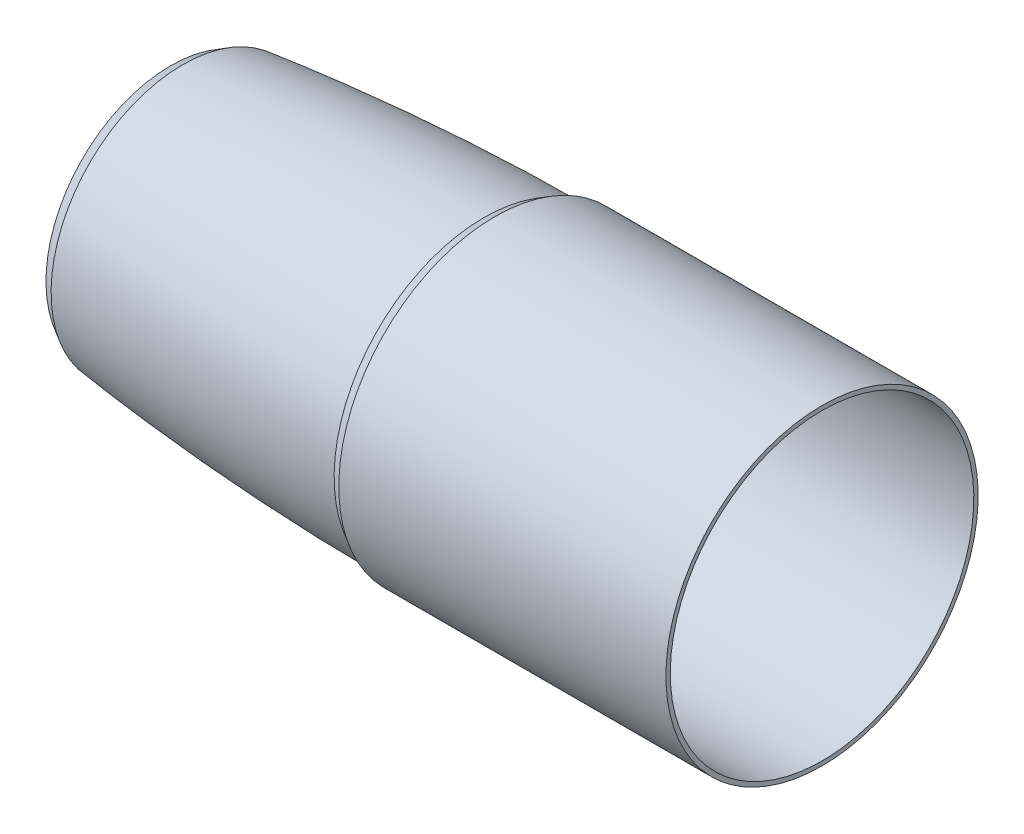
from build123d import *


with BuildPart() as part:
    # Sketch1 → Revolve1 (revolve)
    with BuildSketch(Plane.XY):
        with BuildLine():
            Line((83, 39.6), (0, 39.6))
            Line((0, 39.6), (-2.781127116, 37.994315511))
            ThreePointArc((-2.781127116, 37.994315511), (-41.055601699, 36.760094161), (-79.2, 33.374302495))
            Line((-79.2, 33.374302495), (-82.280577508, 31.595730241))
            ThreePointArc((-82.280577508, 31.595730241), (-41.21630791, 35.347777764), (0, 36.6))
            Line((0, 36.6), (3.290896534, 38.5))
            Line((3.290896534, 38.5), (83, 38.5))
            Line((83, 38.5), (83, 39.6))
        make_face()
    revolve(axis=Axis((0, 0, 0), (-1, 0, 0)))


solid = part.part
